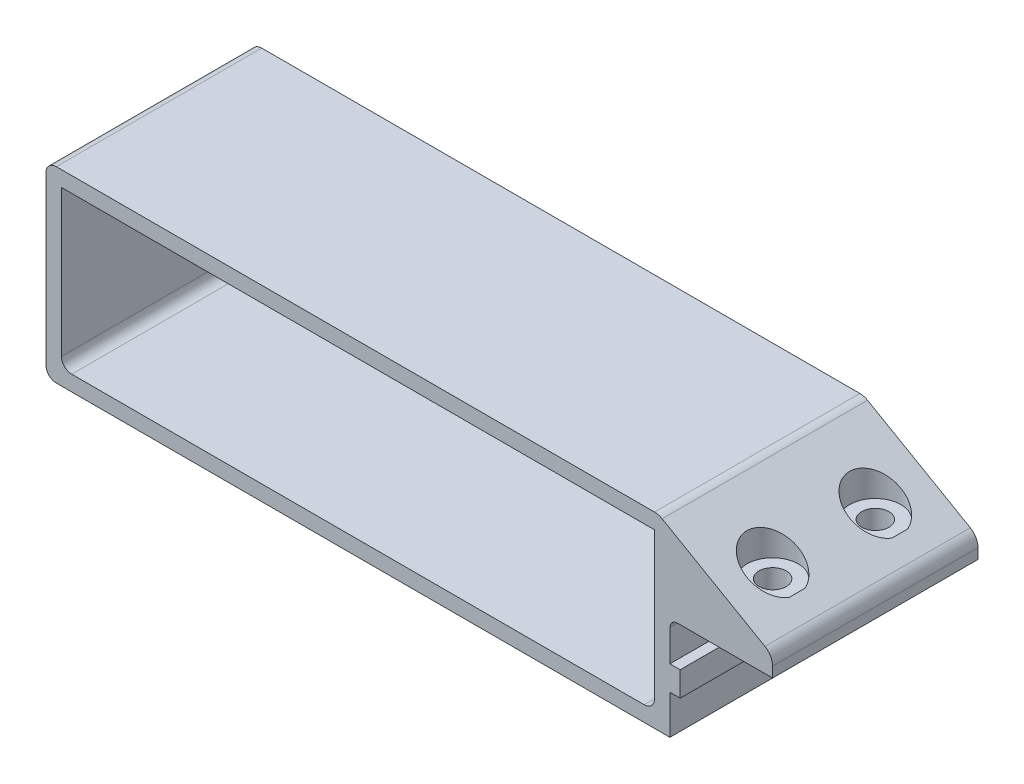
from build123d import *

# Parameters (mm, degrees)
SKETCH1_W                      = 115.5
SKETCH1_H                      = 30.5
SKETCH1_W_2                    = 88
SKETCH1_H_2                    = 12
BOSS_EXTRUDE1_DEPTH            = 3
BOSS_EXTRUDE2_START            = 37
SKETCH1_3_W                    = 115.5
SKETCH1_3_H                    = 30.5
BOSS_EXTRUDE2_DEPTH            = 37
CBORE_FOR_M5_SHCS1_D           = 5.3
CBORE_FOR_M5_SHCS1_CBORE_D     = 10
CBORE_FOR_M5_SHCS1_CBORE_DEPTH = 9.75
FILLET1_R                      = 2
FILLET2_R                      = 1.5


with BuildPart() as part:
    # Sketch1 → Boss-Extrude1 (new body)
    # profile 1 of 2: a face of its own
    with BuildSketch(Plane.XY):
        with BuildLine():
            Line((23, 17), (23, 19))
            ThreePointArc((23, 19), (22.596751829, 20.502291563), (21.495413373, 21.600718909))
            Line((21.495413373, 21.600718909), (1.495413373, 33.100718909))
            ThreePointArc((1.495413373, 33.100718909), (0.773900275, 33.398461379), (0, 33.5))
            Line((0, 33.5), (-118.5, 33.5))
            Line((-118.5, 33.5), (-118.5, -3))
            Line((-118.5, -3), (3, -3))
            Line((3, -3), (3, 4.6))
            Line((3, 4.6), (5, 4.6))
            Line((5, 4.6), (5, 9.4))
            Line((5, 9.4), (3, 9.4))
            Line((3, 9.4), (3, 17))
            Line((3, 17), (23, 17))
        make_face()
        with Locations((-57.75, 15.25)):
            Rectangle(SKETCH1_W, SKETCH1_H, mode=Mode.SUBTRACT)
    # profile 2 of 2: a face of its own
    with BuildSketch(Plane.XY):
        with Locations((-57.75, 15.25)):
            Rectangle(SKETCH1_W, SKETCH1_H)
        with Locations((-66.5, 16)):
            Rectangle(SKETCH1_W_2, SKETCH1_H_2, mode=Mode.SUBTRACT)
    extrude(amount=-BOSS_EXTRUDE1_DEPTH)

    # Sketch1<3> → Boss-Extrude2 (add)
    with BuildSketch(Plane.XY.offset(BOSS_EXTRUDE2_START)):
        with BuildLine():
            Line((23, 17), (23, 19))
            ThreePointArc((23, 19), (22.596751829, 20.502291563), (21.495413373, 21.600718909))
            Line((21.495413373, 21.600718909), (1.495413373, 33.100718909))
            ThreePointArc((1.495413373, 33.100718909), (0.773900275, 33.398461379), (0, 33.5))
            Line((0, 33.5), (-118.5, 33.5))
            Line((-118.5, 33.5), (-118.5, -3))
            Line((-118.5, -3), (3, -3))
            Line((3, -3), (3, 4.6))
            Line((3, 4.6), (5, 4.6))
            Line((5, 4.6), (5, 9.4))
            Line((5, 9.4), (3, 9.4))
            Line((3, 9.4), (3, 17))
            Line((3, 17), (23, 17))
        make_face()
        with Locations((-57.75, 15.25)):
            Rectangle(SKETCH1_3_W, SKETCH1_3_H, mode=Mode.SUBTRACT)
    extrude(amount=-BOSS_EXTRUDE2_DEPTH)

    # CBORE for M5 SHCS1 (through all)
    with Locations(Plane(origin=(0, 33.5, 0), x_dir=(1, 0, 0), z_dir=(0, 1, 0))):
        with Locations((13, -27), (13, -7)):
            CounterBoreHole(CBORE_FOR_M5_SHCS1_D / 2, CBORE_FOR_M5_SHCS1_CBORE_D / 2, CBORE_FOR_M5_SHCS1_CBORE_DEPTH)

    # Fillet1
    fillet1_edges = [part.edges().sort_by_distance(p)[0] for p in [
        (-22.5, 22, -1.5),
        (-110.5, 22, -1.5),
        (-110.5, 10, -1.5),
        (-22.5, 10, -1.5),
        (-118.5, -3, 17),
        (-118.5, 33.5, 17),
        (0, 0, 18.5),
        (-57.75, 0, 0),
        (-115.5, 0, 18.5),
    ]]
    fillet(fillet1_edges, radius=FILLET1_R)

    # Fillet2
    fillet2_edges = [part.edges().sort_by_distance(p)[0] for p in [
        (3, 17, 17),
    ]]
    fillet(fillet2_edges, radius=FILLET2_R)


solid = part.part
